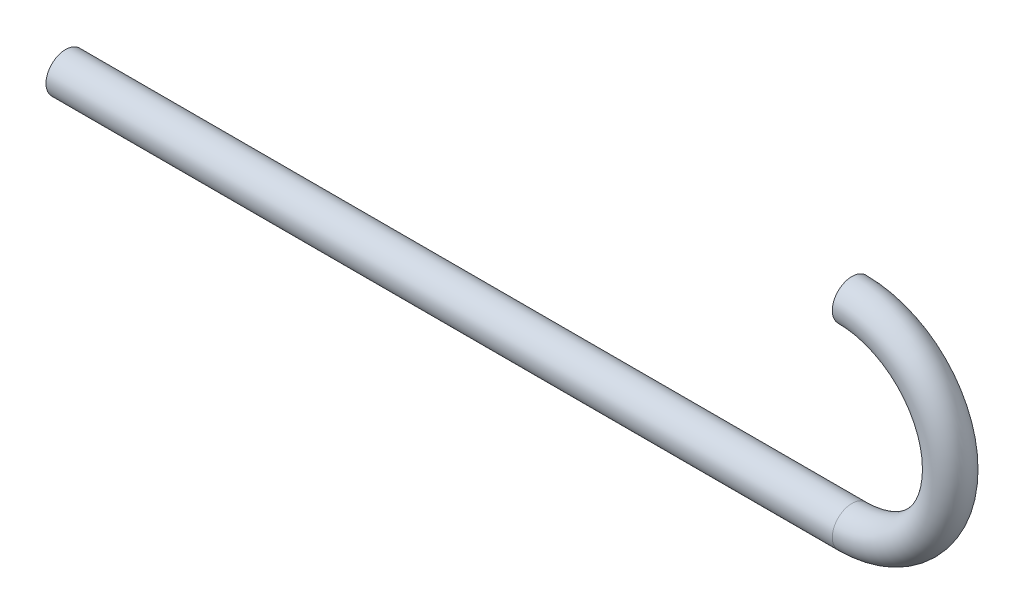
from build123d import *

# Parameters (mm, degrees)
SKETCH_3_R = 3


with BuildPart() as part:
    # 扫描1: sweep along a path in 草图1
    with BuildLine(Plane.XY) as sweep_1_path:
        Line((0, 0), (120, 0))
        ThreePointArc((120, 0), (135, 15), (120, 30))
    # 草图3 → 扫描1 (sweep)
    with BuildSketch(Plane(origin=(0, 0, 0), x_dir=(0, 0, -1), z_dir=(1, 0, 0))):
        Circle(SKETCH_3_R)
    sweep(path=sweep_1_path.line)


solid = part.part
